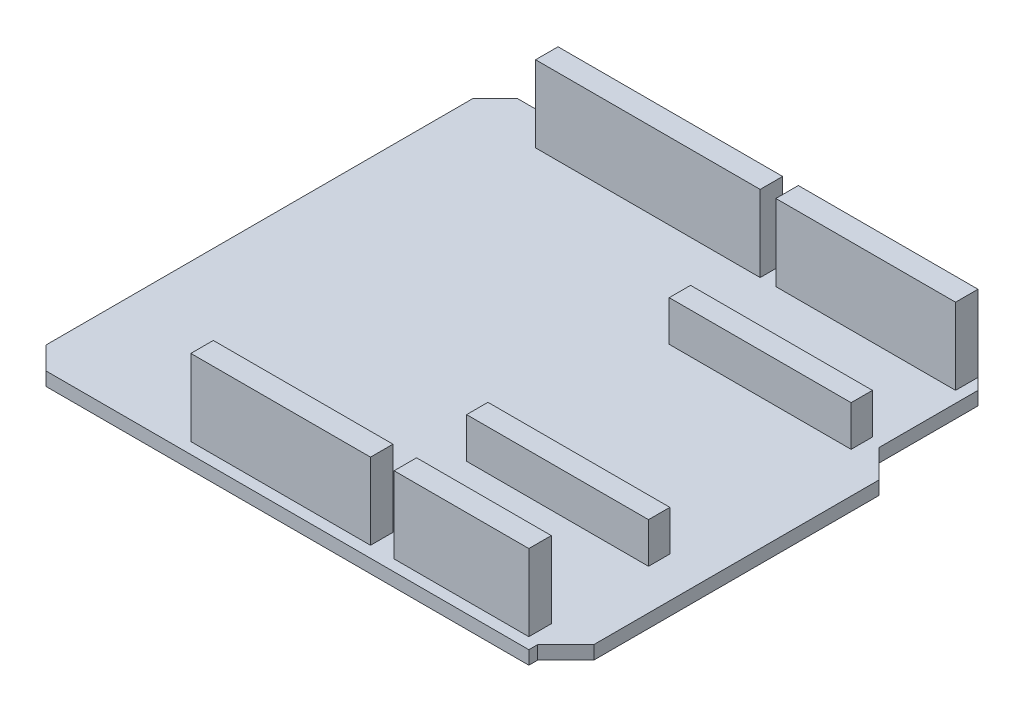
from build123d import *

# Parameters (mm, degrees)
BOSS_EXTRUDE1_DEPTH            = 0.762
F_1_3_1_3_DIAMETER_HOLE1_D     = 1.3
F_1_3_1_3_DIAMETER_HOLE1_DEPTH = 1.524
SKETCH6_W                      = 25.4
SKETCH6_H                      = 2.54
BOSS_EXTRUDE2_DEPTH            = 8.636
SKETCH6_W_2                    = 20.32
BOSS_EXTRUDE2_2_DEPTH          = 8.636
BOSS_EXTRUDE2_3_DEPTH          = 8.636
SKETCH6_W_3                    = 15.24
BOSS_EXTRUDE2_4_DEPTH          = 8.636
SKETCH7_W                      = 20.574
SKETCH7_H                      = 2.413
BOSS_EXTRUDE3_DEPTH            = 4.572
BOSS_EXTRUDE3_2_DEPTH          = 4.572


with BuildPart() as part:
    # Sketch1 → Boss-Extrude1 (new, symmetric)
    with BuildSketch(Plane(origin=(0, 0, 0), x_dir=(1, 0, 0), z_dir=(0, 1, 0))):
        Polygon((57.15, 39.608), (60.325, 36.433), (60.325, 4.175), (57.15, 1), (57.15, 0), (2.54, 0), (0, 2.54), (0, 50.8), (2.54, 53.34), (54.61, 53.34), (57.15, 50.8), align=None)
    extrude(amount=BOSS_EXTRUDE1_DEPTH, both=True)

    # Ø1.3 (1.3) Diameter Hole1
    with Locations(Plane(origin=(0, 0.762, 0), x_dir=(1, 0, 0), z_dir=(0, 1, 0))):
        with Locations((18.923, 2.54), (9.652, 50.8), (21.463, 2.54), (24.003, 2.54), (26.543, 2.54), (29.083, 2.54), (31.623, 2.54), (34.163, 2.54), (36.703, 2.54), (12.192, 50.8), (14.732, 50.8), (17.272, 50.8), (19.812, 50.8), (22.352, 50.8), (24.892, 50.8), (27.432, 50.8), (29.972, 50.8), (32.512, 50.8), (41.91, 2.54), (36.83, 50.8), (44.45, 2.54), (46.99, 2.54), (49.53, 2.54), (52.07, 2.54), (54.61, 2.54), (39.37, 50.8), (41.91, 50.8), (44.45, 50.8), (46.99, 50.8), (49.53, 50.8), (52.07, 50.8), (54.61, 50.8), (91.567, 2.54), (89.027, 2.54), (86.487, 2.54), (83.947, 2.54), (81.407, 2.54), (78.867, 2.54), (76.327, 2.54)):
            Hole(F_1_3_1_3_DIAMETER_HOLE1_D / 2, depth=F_1_3_1_3_DIAMETER_HOLE1_DEPTH)


with BuildPart() as body_2:
    # Sketch6 → Boss-Extrude2 (new body)
    with BuildSketch(Plane(origin=(0, 0.762, 0), x_dir=(1, 0, 0), z_dir=(0, 1, 0))):
        with Locations((21.082, 50.8)):
            Rectangle(SKETCH6_W, SKETCH6_H)
    extrude(amount=BOSS_EXTRUDE2_DEPTH)


with BuildPart() as body_3:
    # Sketch6 → Boss-Extrude2 2 (new body)
    with BuildSketch(Plane(origin=(0, 0.762, 0), x_dir=(1, 0, 0), z_dir=(0, 1, 0))):
        with Locations((45.72, 50.8)):
            Rectangle(SKETCH6_W_2, SKETCH6_H)
    extrude(amount=BOSS_EXTRUDE2_2_DEPTH)


with BuildPart() as body_4:
    # Sketch6 → Boss-Extrude2 3 (new body)
    with BuildSketch(Plane(origin=(0, 0.762, 0), x_dir=(1, 0, 0), z_dir=(0, 1, 0))):
        with Locations((27.813, 2.54)):
            Rectangle(SKETCH6_W_2, SKETCH6_H)
    extrude(amount=BOSS_EXTRUDE2_3_DEPTH)


with BuildPart() as body_5:
    # Sketch6 → Boss-Extrude2 4 (new body)
    with BuildSketch(Plane(origin=(0, 0.762, 0), x_dir=(1, 0, 0), z_dir=(0, 1, 0))):
        with Locations((48.26, 2.54)):
            Rectangle(SKETCH6_W_3, SKETCH6_H)
    extrude(amount=BOSS_EXTRUDE2_4_DEPTH)


with BuildPart() as body_6:
    # Sketch7 → Boss-Extrude3 (new body)
    with BuildSketch(Plane(origin=(0, 0.762, 0), x_dir=(1, 0, 0), z_dir=(0, 1, 0))):
        with Locations((45.466, 39.0525)):
            Rectangle(SKETCH7_W, SKETCH7_H)
    extrude(amount=BOSS_EXTRUDE3_DEPTH)


with BuildPart() as body_7:
    # Sketch7 → Boss-Extrude3 2 (new body)
    with BuildSketch(Plane(origin=(0, 0.762, 0), x_dir=(1, 0, 0), z_dir=(0, 1, 0))):
        with Locations((45.466, 16.1395)):
            Rectangle(SKETCH7_W, SKETCH7_H)
    extrude(amount=BOSS_EXTRUDE3_2_DEPTH)


solid = Compound([part.part, body_2.part, body_3.part, body_4.part, body_5.part, body_6.part, body_7.part])
